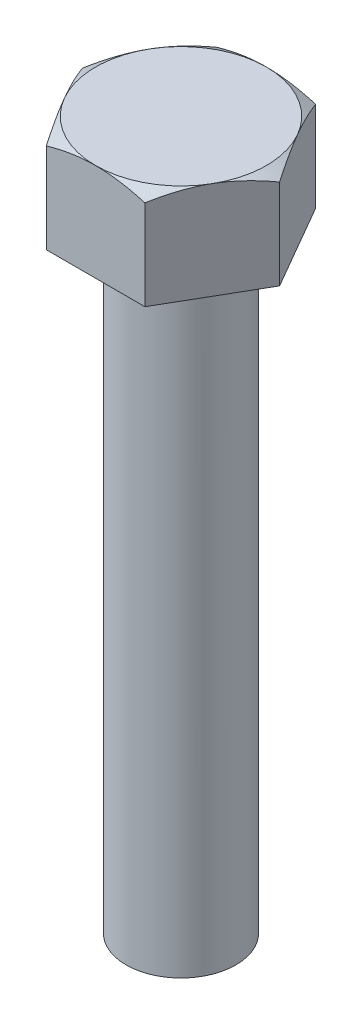
from build123d import *

# Parameters (mm, degrees)
BOSS_EXTRUDE1_DEPTH = 4
SKETCH9_R           = 2.25
BOSS_EXTRUDE2_DEPTH = 25


with BuildPart() as part:
    # Sketch3 → Boss-Extrude1 (new body)
    with BuildSketch(Plane(origin=(0, 0, 0), x_dir=(1, 0, 0), z_dir=(0, 1, 0))):
        Polygon((4.041451884, 0), (2.020725942, 3.5), (-2.020725942, 3.5), (-4.041451884, 0), (-2.020725942, -3.5), (2.020725942, -3.5), align=None)
    extrude(amount=-BOSS_EXTRUDE1_DEPTH)

    # Sketch8 → Cut-Revolve2 (revolve, cut)
    with BuildSketch(Plane.XY):
        Polygon((3.5, 0), (4.041451884, 0), (4.041451884, -0.312607391), align=None)
    revolve(axis=Axis((0, 2.328087819, 0), (0, -1, 0)), mode=Mode.SUBTRACT)

    # Sketch9 → Boss-Extrude2 (add)
    with BuildSketch(Plane.XZ.offset(4)):
        with Locations(Location((0, 0, 0), (0, 0, 90))):
            Circle(SKETCH9_R)
    extrude(amount=BOSS_EXTRUDE2_DEPTH)


solid = part.part
